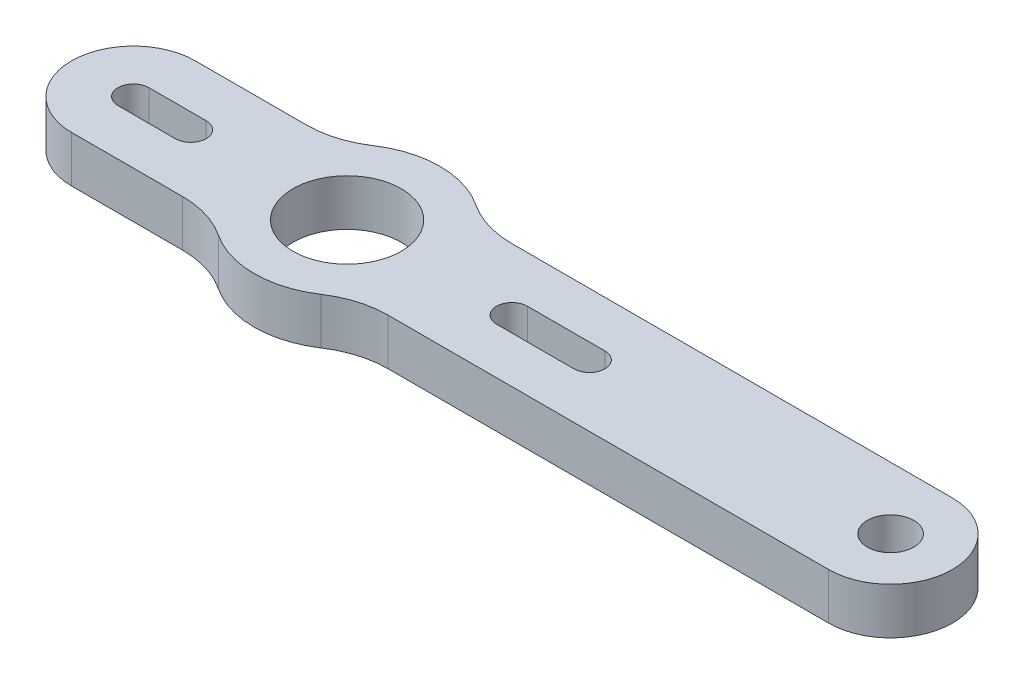
from build123d import *

# Parameters (mm, degrees)
ESBO_O1_R                  = 6
RESSALTO_EXTRUS_O1_DEPTH   = 3
FURO_DE_DI_METRO_3_0_3_1_D = 3
FURO_DE_DI_METRO_7_0_7_1_D = 7
FILETE1_R                  = 6


with BuildPart() as part:
    # Esboço1 → Ressalto-extrusão1 (new body)
    # profile 1 of 2: a face of its own
    with BuildSketch(Plane(origin=(0, 0, 0), x_dir=(1, 0, 0), z_dir=(0, 1, 0))):
        with Locations((13.8, 0)):
            Circle(ESBO_O1_R)
    # profile 2 of 2: a face of its own
    with BuildSketch(Plane(origin=(0, 0, 0), x_dir=(1, 0, 0), z_dir=(0, 1, 0))):
        with BuildLine():
            Line((0, 4), (48.9, 4))
            ThreePointArc((48.9, 4), (52.9, 0), (48.9, -4))
            Line((48.9, -4), (0, -4))
            ThreePointArc((0, -4), (-4, 0), (0, 4))
        make_face()
        with BuildLine():
            Line((0, 1), (3.7, 1))
            ThreePointArc((3.7, 1), (4.7, 0), (3.7, -1))
            Line((3.7, -1), (0, -1))
            ThreePointArc((0, -1), (-1, 0), (0, 1))
        make_face(mode=Mode.SUBTRACT)
        with BuildLine():
            Line((24.45, 1), (29.45, 1))
            ThreePointArc((29.45, 1), (30.45, 0), (29.45, -1))
            Line((29.45, -1), (24.45, -1))
            ThreePointArc((24.45, -1), (23.45, 0), (24.45, 1))
        make_face(mode=Mode.SUBTRACT)
    extrude(amount=RESSALTO_EXTRUS_O1_DEPTH)

    # Furo de diâmetro Ø3.0 (3)1 (through all)
    with Locations(Plane(origin=(0, 3, 0), x_dir=(1, 0, 0), z_dir=(0, 1, 0))):
        with Locations((48.9, 0)):
            Hole(FURO_DE_DI_METRO_3_0_3_1_D / 2)

    # Furo de diâmetro Ø7.0 (7)1 (through all)
    with Locations(Plane(origin=(0, 3, 0), x_dir=(1, 0, 0), z_dir=(0, 1, 0))):
        with Locations((13.8, 0)):
            Hole(FURO_DE_DI_METRO_7_0_7_1_D / 2)

    # Filete1
    filete1_edges = [part.edges().sort_by_distance(p)[0] for p in [
        (9.327864045, 1.5, -4),
        (18.272135955, 1.5, -4),
        (18.272135955, 1.5, 4),
        (9.327864045, 1.5, 4),
    ]]
    fillet(filete1_edges, radius=FILETE1_R)


solid = part.part
